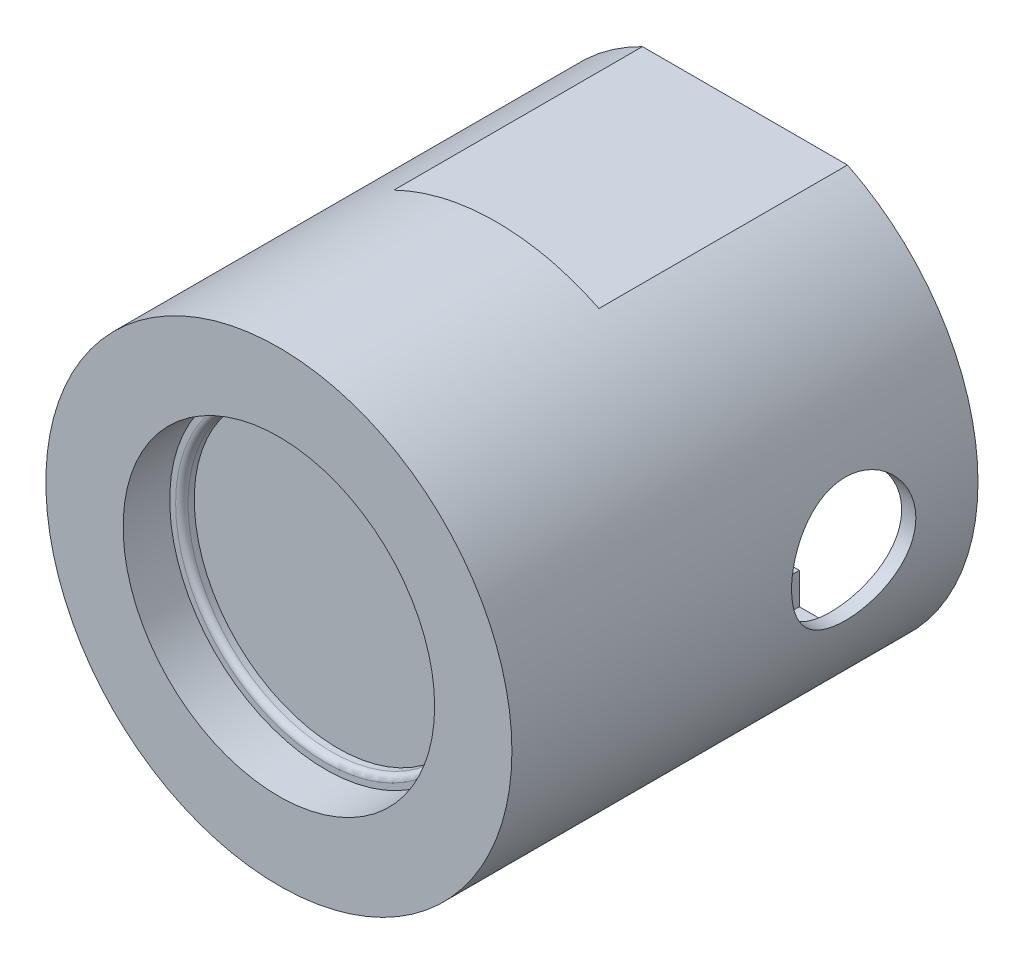
from build123d import *

# Parameters (mm, degrees)
SKETCH3_R               = 19.05
BOSS_EXTRUDE1_DEPTH     = 38.1
CUT_EXTRUDE2_DEPTH      = 25.4
CUT_EXTRUDE4_DEPTH      = 20.32
SKETCH11_R              = 12.732490025
CUT_EXTRUDE5_DEPTH      = 3.81
SKETCH12_R              = 11.742927305
CUT_EXTRUDE6_DEPTH      = 1.016
FILLET2_R               = 0.508
CUT_EXTRUDE7_DEPTH      = 47.6627796
CUT_EXTRUDE7_DEPTH_BACK = 47.6627796
SKETCH14_R              = 5.08


with BuildPart() as part:
    # Sketch3 → Boss-Extrude1 (new body)
    with BuildSketch(Plane.XY):
        Circle(SKETCH3_R)
    extrude(amount=-BOSS_EXTRUDE1_DEPTH)

    # Sketch6 → Cut-Extrude2 (cut)
    with BuildSketch(Plane(origin=(0, 0, -38.1), x_dir=(-1, 0, 0), z_dir=(0, 0, -1))):
        with BuildLine():
            Line((4.445692932, 13.555581222), (-4.445692932, 13.555581222))
            Line((-4.445692932, 13.555581222), (-4.445692932, 16.13135994))
            Line((-4.445692932, 16.13135994), (-7.735378966, 16.13135994))
            ThreePointArc((-7.735378966, 16.13135994), (-17.89013307, 0), (-7.735378966, -16.13135994))
            Line((-7.735378966, -16.13135994), (-4.445692932, -16.13135994))
            Line((-4.445692932, -16.13135994), (-4.445692932, -13.555581222))
            Line((-4.445692932, -13.555581222), (4.445692932, -13.555581222))
            Line((4.445692932, -13.555581222), (4.445692932, -16.13135994))
            Line((4.445692932, -16.13135994), (7.735378966, -16.13135994))
            ThreePointArc((7.735378966, -16.13135994), (17.89013307, 0), (7.735378966, 16.13135994))
            Line((7.735378966, 16.13135994), (4.445692932, 16.13135994))
            Line((4.445692932, 16.13135994), (4.445692932, 13.555581222))
        make_face()
    extrude(amount=-CUT_EXTRUDE2_DEPTH, mode=Mode.SUBTRACT)

    # Sketch10 → Cut-Extrude4 (cut)
    with BuildSketch(Plane(origin=(0, 0, -38.1), x_dir=(-1, 0, 0), z_dir=(0, 0, -1))):
        with BuildLine():
            Line((-8.382, 17.106857572), (8.382, 17.106857572))
            ThreePointArc((8.382, 17.106857572), (0, 19.054089968), (-8.382, 17.106857572))
        make_face()
        with BuildLine():
            Line((-8.382, -17.106857572), (8.382, -17.106857572))
            ThreePointArc((8.382, -17.106857572), (0, -19.054089968), (-8.382, -17.106857572))
        make_face()
    extrude(amount=-CUT_EXTRUDE4_DEPTH, mode=Mode.SUBTRACT)

    # Sketch11 → Cut-Extrude5 (cut)
    with BuildSketch(Plane.XY):
        Circle(SKETCH11_R)
    extrude(amount=-CUT_EXTRUDE5_DEPTH, mode=Mode.SUBTRACT)

    # Sketch12 → Cut-Extrude6 (cut)
    with BuildSketch(Plane.XY.offset(-3.81)):
        Circle(SKETCH12_R)
    extrude(amount=-CUT_EXTRUDE6_DEPTH, mode=Mode.SUBTRACT)

    # Fillet2
    fillet2_edges = [part.edges().sort_by_distance(p)[0] for p in [
        (-11.742927305, 0, -3.81),
    ]]
    fillet(fillet2_edges, radius=FILLET2_R)

    # Sketch14 → Cut-Extrude7 (cut, two sides: drawn at the far end of the back side and taken through both)
    with BuildSketch(Plane(origin=(0, 0, 0), x_dir=(0, 0, -1), z_dir=(1, 0, 0)).offset(-CUT_EXTRUDE7_DEPTH_BACK)):
        with Locations((27.94, 0)):
            Circle(SKETCH14_R)
    extrude(amount=CUT_EXTRUDE7_DEPTH + CUT_EXTRUDE7_DEPTH_BACK, mode=Mode.SUBTRACT)


solid = part.part
